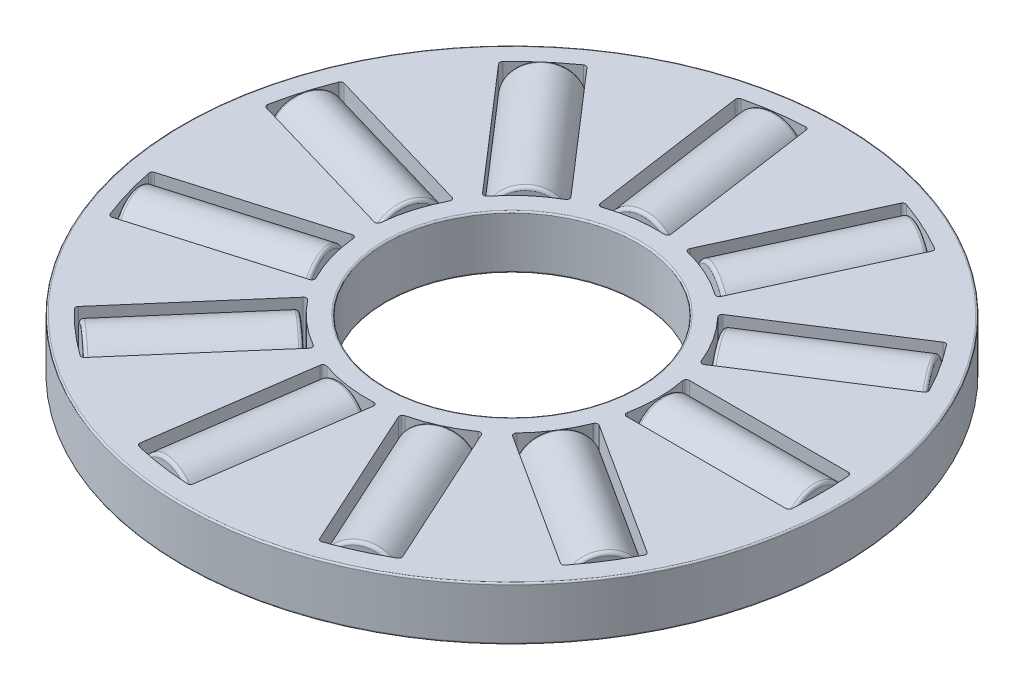
from build123d import *

# Parameters (mm, degrees)
SKETCH3_W                = 6.4875
SKETCH3_H                = 1.7
FILLET1_R                = 0.05
CUT_EXTRUDE1_DEPTH       = 15.873550491
FILLET5_R                = 0.1
CIRPATTERN1_COUNT        = 11
FILLET5_OF_CIRPATTERN1_R = 0.1
SKETCH5_W                = 4.96375
SKETCH5_H                = 0.998287418
FILLET6_R                = 0.1
CIRPATTERN2_COUNT        = 11


with BuildPart() as part:
    # Sketch3 → Revolve1 (revolve)
    with BuildSketch(Plane(origin=(0, 0, 0), x_dir=(0, 0, -1), z_dir=(1, 0, 0))):
        with Locations((7.25625, 0)):
            Rectangle(SKETCH3_W, SKETCH3_H)
    revolve(axis=Axis((0, 1, 0), (0, -1, 0)))

    # Fillet1
    fillet1_edges = [part.edges().sort_by_distance(p)[0] for p in [
        (0, -0.85, 4.0125),
        (0, -0.85, 10.5),
        (0, 0.85, 10.5),
        (0, 0.85, 4.0125),
    ]]
    fillet(fillet1_edges, radius=FILLET1_R)

    # Sketch4 → Cut-Extrude1 (cut, symmetric)
    with BuildSketch(Plane(origin=(0, 0, 0), x_dir=(1, 0, 0), z_dir=(0, 1, 0))):
        with BuildLine():
            Line((4.528777813, 0.998287418), (9.811846334, 0.998287418))
            ThreePointArc((9.811846334, 0.998287418), (9.8625, 0), (9.811846334, -0.998287418))
            Line((9.811846334, -0.998287418), (4.528777813, -0.998287418))
            ThreePointArc((4.528777813, -0.998287418), (4.6375, 0), (4.528777813, 0.998287418))
        make_face()
    cut_extrude1 = extrude(amount=CUT_EXTRUDE1_DEPTH, both=True, mode=Mode.SUBTRACT)

    # Fillet5
    fillet5_edges = [part.edges().sort_by_distance(p)[0] for p in [
        (9.811846334, 0, -0.998287418),
        (9.811846334, 0, 0.998287418),
        (4.528777813, 0, -0.998287418),
        (4.528777813, 0, 0.998287418),
    ]]
    fillet(fillet5_edges, radius=FILLET5_R)

    # CirPattern1: Cut-Extrude1 ×11 about axis
    cirpattern1_axis = Axis((0, 1, 0), (0, -1, 0))
    for i in range(1, CIRPATTERN1_COUNT):
        add(cut_extrude1.rotate(cirpattern1_axis, i * 360 / CIRPATTERN1_COUNT), mode=Mode.SUBTRACT)

    # Fillet5 of CirPattern1
    fillet5_of_cirpattern1_edges = [part.edges().sort_by_distance(p)[0] for p in [
        (8.793965318, 0, 4.464871806),
        (7.714535467, 0, 6.14449744),
        (4.34956526, 0, 1.608629322),
        (3.270135409, 0, 3.288254956),
        (4.984062448, 0, 8.510465778),
        (3.167914097, 0, 9.339872939),
        (2.78939647, 0, 3.704817618),
        (0.973248119, 0, 4.534224779),
        (-0.408245033, 0, 9.854046998),
        (-2.384497615, 0, 9.569904773),
        (0.343614009, 0, 4.624752497),
        (-1.632638573, 0, 4.340610273),
        (-5.670937601, 0, 8.069037922),
        (-7.179848183, 0, 6.76155946),
        (-2.211263472, 0, 4.076361136),
        (-3.720174054, 0, 2.768882674),
        (-9.133147549, 0, 3.722166318),
        (-9.695647682, 0, 1.806466792),
        (-4.064080424, 0, 2.233753916),
        (-4.626580558, 0, 0.31805439),
        (-9.695647682, 0, -1.806466792),
        (-9.133147549, 0, -3.722166318),
        (-4.626580558, 0, -0.31805439),
        (-4.064080424, 0, -2.233753916),
        (-7.179848183, 0, -6.76155946),
        (-5.670937601, 0, -8.069037922),
        (-3.720174054, 0, -2.768882674),
        (-2.211263472, 0, -4.076361136),
        (-2.384497615, 0, -9.569904773),
        (-0.408245033, 0, -9.854046998),
        (-1.632638573, 0, -4.340610273),
        (0.343614009, 0, -4.624752497),
        (3.167914097, 0, -9.339872939),
        (4.984062448, 0, -8.510465778),
        (0.973248119, 0, -4.534224779),
        (2.78939647, 0, -3.704817618),
        (7.714535467, 0, -6.14449744),
        (8.793965318, 0, -4.464871806),
        (3.270135409, 0, -3.288254956),
        (4.34956526, 0, -1.608629322),
    ]]
    fillet(fillet5_of_cirpattern1_edges, radius=FILLET5_OF_CIRPATTERN1_R)


with BuildPart() as body_2:
    # Sketch5 → Revolve2 (revolve)
    with BuildSketch(Plane(origin=(0, 0, 0), x_dir=(1, 0, 0), z_dir=(0, 1, 0))):
        with Locations((7.25, 0.499143709)):
            Rectangle(SKETCH5_W, SKETCH5_H)
    revolve(axis=Axis((9.8625, 0, 0), (-1, 0, 0)))

    # Fillet6
    fillet6_edges = [body_2.edges().sort_by_distance(p)[0] for p in [
        (4.768125, 0, 0.998287418),
        (9.731875, 0, 0.998287418),
    ]]
    fillet(fillet6_edges, radius=FILLET6_R)


with BuildPart() as cirpattern2_1:
    # CirPattern2: pattern copy
    add(body_2.part.rotate(Axis((0, 1, 0), (0, -1, 0)), 1 * 360 / CIRPATTERN2_COUNT))


with BuildPart() as cirpattern2_2:
    # CirPattern2: pattern copy
    add(body_2.part.rotate(Axis((0, 1, 0), (0, -1, 0)), 2 * 360 / CIRPATTERN2_COUNT))


with BuildPart() as cirpattern2_3:
    # CirPattern2: pattern copy
    add(body_2.part.rotate(Axis((0, 1, 0), (0, -1, 0)), 3 * 360 / CIRPATTERN2_COUNT))


with BuildPart() as cirpattern2_4:
    # CirPattern2: pattern copy
    add(body_2.part.rotate(Axis((0, 1, 0), (0, -1, 0)), 4 * 360 / CIRPATTERN2_COUNT))


with BuildPart() as cirpattern2_5:
    # CirPattern2: pattern copy
    add(body_2.part.rotate(Axis((0, 1, 0), (0, -1, 0)), 5 * 360 / CIRPATTERN2_COUNT))


with BuildPart() as cirpattern2_6:
    # CirPattern2: pattern copy
    add(body_2.part.rotate(Axis((0, 1, 0), (0, -1, 0)), 6 * 360 / CIRPATTERN2_COUNT))


with BuildPart() as cirpattern2_7:
    # CirPattern2: pattern copy
    add(body_2.part.rotate(Axis((0, 1, 0), (0, -1, 0)), 7 * 360 / CIRPATTERN2_COUNT))


with BuildPart() as cirpattern2_8:
    # CirPattern2: pattern copy
    add(body_2.part.rotate(Axis((0, 1, 0), (0, -1, 0)), 8 * 360 / CIRPATTERN2_COUNT))


with BuildPart() as cirpattern2_9:
    # CirPattern2: pattern copy
    add(body_2.part.rotate(Axis((0, 1, 0), (0, -1, 0)), 9 * 360 / CIRPATTERN2_COUNT))


with BuildPart() as cirpattern2_10:
    # CirPattern2: pattern copy
    add(body_2.part.rotate(Axis((0, 1, 0), (0, -1, 0)), 10 * 360 / CIRPATTERN2_COUNT))


solid = Compound([part.part, body_2.part, cirpattern2_1.part, cirpattern2_2.part, cirpattern2_3.part, cirpattern2_4.part, cirpattern2_5.part, cirpattern2_6.part, cirpattern2_7.part, cirpattern2_8.part, cirpattern2_9.part, cirpattern2_10.part])
